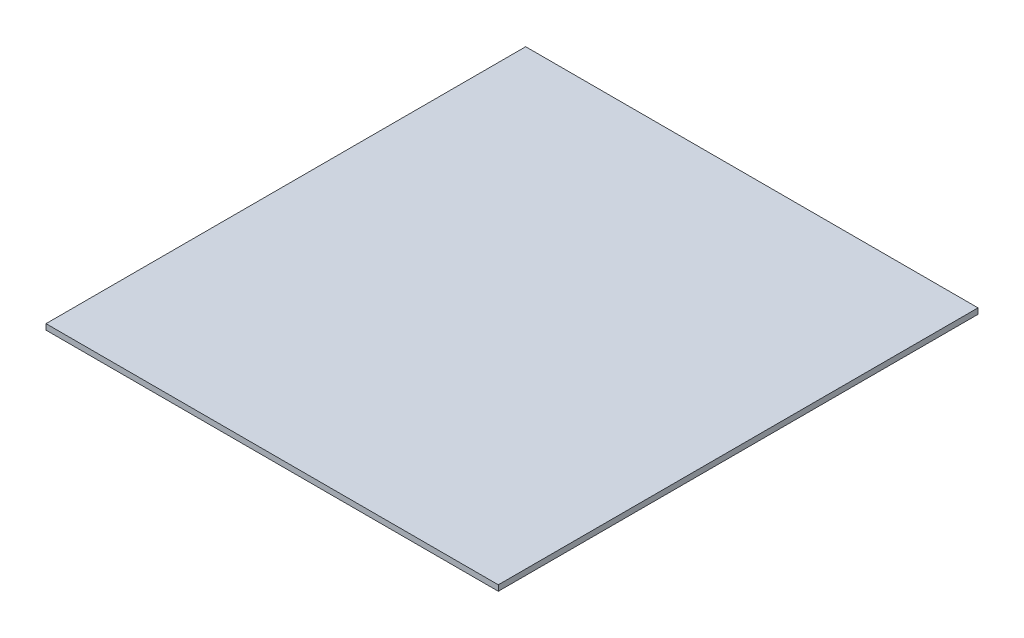
from build123d import *

# Parameters (mm, degrees)
SKETCH1_W           = 157
SKETCH1_H           = 166.5
BOSS_EXTRUDE1_DEPTH = 1.96


with BuildPart() as part:
    # Sketch1 → Boss-Extrude1 (new body)
    with BuildSketch(Plane(origin=(0, 0, 0), x_dir=(1, 0, 0), z_dir=(0, 1, 0))):
        Rectangle(SKETCH1_W, SKETCH1_H)
    extrude(amount=BOSS_EXTRUDE1_DEPTH)


solid = part.part
